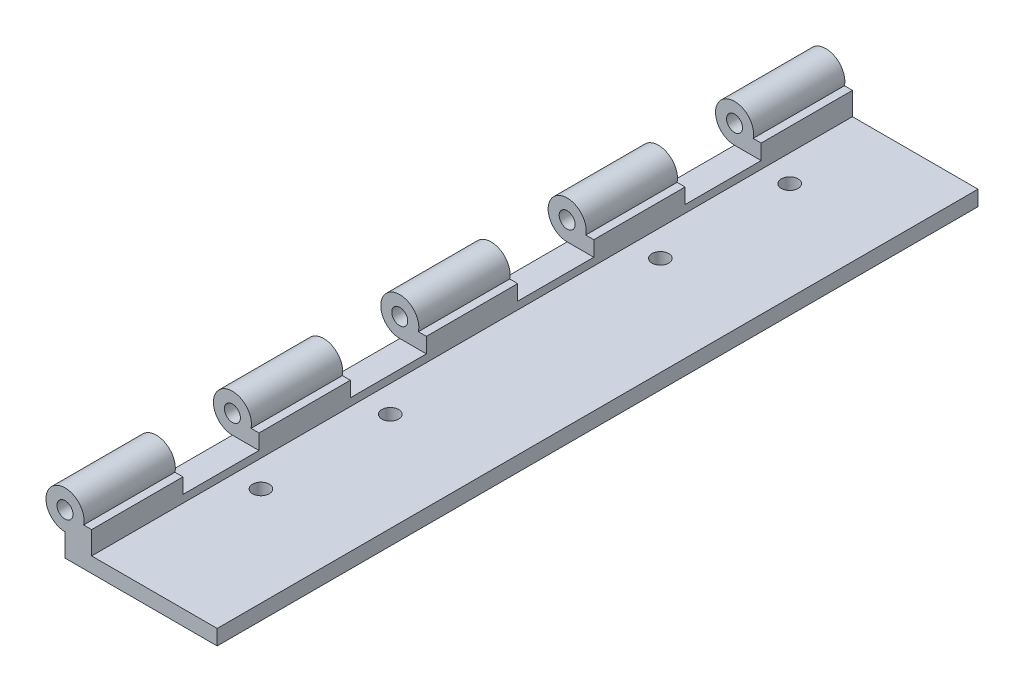
from build123d import *

# Parameters (mm, degrees)
SKETCH_1_W                     = 9.5
SKETCH_1_H                     = 13.25
EXTRUDE_1_DEPTH                = 2
EXTRUDE_2_DEPTH                = 12
PATTERN_LINEAR_1_COUNT         = 5
PATTERN_LINEAR_1_PITCH         = 22
HOLE_WIZARD_2_2_2_2_1_D        = 2.1
EXTRUDE_3_DEPTH                = 12
SKETCH_7_W                     = 1.05
SKETCH_7_H                     = 15
EXTRUDE_4_DEPTH                = 110
SKETCH_13_W                    = 1
SKETCH_13_H                    = 38.681287062
HOLE_WIZARD_2_0_2_2_AT_2_COUNT = 2
HOLE_WIZARD_2_0_2_2_AT_2_PITCH = 47
CUT_EXTRUDE_1_DEPTH            = 140.431241936
CUT_EXTRUDE_1_DEPTH_BACK       = 140.431241936
SKETCH_14_W                    = 52.846717088
SKETCH_14_H                    = 8
EXTRUDE23_DEPTH                = 109
EXTRUDE23_DEPTH_BACK           = 77
SKETCH18_W                     = 126.116691802
SKETCH18_H                     = 130.968537131
SKETCH20_W                     = 20
SKETCH20_H                     = 100
EXTRUDE24_DEPTH                = 2
SKETCH21_R                     = 1.1
EXTRUDE25_DEPTH                = 2
EXTRUDE26_DEPTH                = 136
EXTRUDE26_DEPTH_BACK           = 62
SKETCH22_W                     = 135.680863596
SKETCH22_H                     = 114.529775135
SKETCH_15_W                    = 16.5
SKETCH_15_H                    = 100
CUT_EXTRUDE_2_DEPTH            = 1
SKETCH_16_W                    = 20
SKETCH_16_H                    = 100
SKETCH_16_R                    = 1.1
EXTRUDE_5_DEPTH                = 1


with BuildPart() as part:
    # 草图1 → 凸台-拉伸1 (new body)
    with BuildSketch(Plane(origin=(0, 0, 0), x_dir=(1, 0, 0), z_dir=(0, 1, 0))):
        Polygon((21.5, 0), (21.5, 110), (9, 110), (0, 101), (0, 0), align=None)
        Polygon((19.121320344, 101), (4.242640687, 101), (8.121320344, 104.878679656), (19.121320344, 104.878679656), align=None, mode=Mode.SUBTRACT)
        with Locations((10.75, 12.625)):
            Rectangle(SKETCH_1_W, SKETCH_1_H, mode=Mode.SUBTRACT)
        with Locations((10.75, 37.875)):
            Rectangle(SKETCH_1_W, SKETCH_1_H, mode=Mode.SUBTRACT)
        with Locations((10.75, 63.125)):
            Rectangle(SKETCH_1_W, SKETCH_1_H, mode=Mode.SUBTRACT)
        with Locations((10.75, 88.375)):
            Rectangle(SKETCH_1_W, SKETCH_1_H, mode=Mode.SUBTRACT)
    extrude(amount=EXTRUDE_1_DEPTH)

    # 草图2 → 凸台-拉伸2 (add)
    with BuildSketch(Plane(origin=(0, 0, -101), x_dir=(-1, 0, 0), z_dir=(0, 0, -1))):
        with BuildLine():
            Line((0, 2), (0, 0))
            Line((0, 0), (3.5, 0))
            ThreePointArc((3.5, 0), (5.08113883, 4.436491673), (1.050510257, 2))
            Line((1.050510257, 2), (0, 2))
        make_face()
    extrude_2 = extrude(amount=-EXTRUDE_2_DEPTH)

    # 阵列(线性)1: 凸台-拉伸2 ×5
    with Locations(*[(0, 0, i * PATTERN_LINEAR_1_PITCH) for i in range(1, PATTERN_LINEAR_1_COUNT)]):
        add(extrude_2)

    # Ø2.2 (2.2) 直径孔1 (through all)
    with Locations(Plane(origin=(0, 0, -101), x_dir=(-1, 0, 0), z_dir=(0, 0, -1))):
        with Locations((3.5, 2.5)):
            Hole(HOLE_WIZARD_2_2_2_2_1_D / 2)

    # 草图8 → 凸台-拉伸4 (add)
    with BuildSketch(Plane.XY):
        with BuildLine():
            ThreePointArc((31.5, 0), (34.178784027, 0.532843272), (36.449747468, 2.050252532))
            Line((36.449747468, 2.050252532), (39.577164466, 5.17766953))
            ThreePointArc((39.577164466, 5.17766953), (57.254833996, 12.5), (74.932503526, 5.17766953))
            Line((74.932503526, 5.17766953), (76.346717088, 6.591883092))
            ThreePointArc((76.346717088, 6.591883092), (57.254833996, 14.5), (38.162950904, 6.591883092))
            Line((38.162950904, 6.591883092), (35.035533906, 3.464466094))
            ThreePointArc((35.035533906, 3.464466094), (33.413417162, 2.380602337), (31.5, 2))
            Line((31.5, 2), (21.5, 2))
            Line((21.5, 2), (21.5, 0))
            Line((21.5, 0), (31.5, 0))
        make_face()
    extrude(amount=-EXTRUDE_4_DEPTH)

    # 草图13 → Ø2.0 (2) 直径孔2 (revolve, cut)
    with BuildSketch(Plane(origin=(66.489377866, 12.871700761, -5), x_dir=(-0.9396926207859126, 0.34202014332565694, 0), z_dir=(0, 0, 1))):
        with Locations((0.5, 19.340643531)):
            Rectangle(SKETCH_13_W, SKETCH_13_H)
    hole_wizard_2_0_2_2 = revolve(axis=Axis((68.661205776, 18.838748903, -5), (-0.3420201433256569, -0.9396926207859128, 0)), mode=Mode.SUBTRACT)

    # Ø2.0 (2) 直径孔2 at 2: Ø2.0 (2) 直径孔2 ×2
    with Locations(*[(0, 0, -i * HOLE_WIZARD_2_0_2_2_AT_2_PITCH) for i in range(1, HOLE_WIZARD_2_0_2_2_AT_2_COUNT)]):
        add(hole_wizard_2_0_2_2, mode=Mode.SUBTRACT)

    # 草图14 → 切除-拉伸1 (cut, two sides: drawn at the far end of the back side and taken through both)
    with BuildSketch(Plane(origin=(0, 2, 0), x_dir=(1, 0, 0), z_dir=(0, 1, 0)).offset(-CUT_EXTRUDE_1_DEPTH_BACK)):
        with BuildLine():
            add(Edge.make_bspline(
                [(65.543349365, 52), (65.543349365, 51.867858182), (65.568139282, 51.738193315), (65.663651177, 51.49599396), (65.734288369, 51.385069362), (65.909329104, 51.20058787), (66.014984918, 51.126085586), (66.242291721, 51.026337096), (66.366299142, 51.000069682), (66.611454679, 50.999930602), (66.734292904, 51.025809235), (66.960669981, 51.125923854), (67.063423157, 51.199243917), (67.237262204, 51.385832013), (67.305425299, 51.495895945), (67.398649167, 51.738239585), (67.422691544, 51.869119898), (67.422777552, 52.130169285), (67.398544475, 52.261724961), (67.306168595, 52.502477284), (67.237041074, 52.614131138), (67.065581718, 52.798710334), (66.962099904, 52.873181003), (66.736029766, 52.973681753), (66.61428089, 52.999865952), (66.366377399, 53.000133023), (66.24402893, 52.974291959), (66.014886358, 52.874003493), (65.90992169, 52.799906628), (65.647004042, 52.52319771), (65.543349365, 52.264283637), (65.543349365, 52)],
                knots=[0, 0, 0, 0, 0.0625, 0.0625, 0.125, 0.125, 0.1875, 0.1875, 0.25, 0.25, 0.3125, 0.3125, 0.375, 0.375, 0.4375, 0.4375, 0.5, 0.5, 0.5625, 0.5625, 0.625, 0.625, 0.6875, 0.6875, 0.75, 0.75, 0.8125, 0.8125, 0.875, 0.875, 1, 1, 1, 1], degree=3))
        make_face()
        with BuildLine():
            add(Edge.make_bspline(
                [(65.543349365, 5), (65.543349365, 4.867858182), (65.568139282, 4.738193315), (65.663651177, 4.49599396), (65.734288369, 4.385069362), (65.909329104, 4.20058787), (66.014984918, 4.126085586), (66.242291721, 4.026337096), (66.366299142, 4.000069682), (66.611454679, 3.999930602), (66.734292904, 4.025809235), (66.960669981, 4.125923854), (67.063423157, 4.199243917), (67.237262204, 4.385832013), (67.305425299, 4.495895945), (67.398649167, 4.738239585), (67.422691544, 4.869119898), (67.422777552, 5.130169285), (67.398544475, 5.261724961), (67.306168595, 5.502477284), (67.237041074, 5.614131138), (67.065581718, 5.798710334), (66.962099904, 5.873181003), (66.736029766, 5.973681753), (66.61428089, 5.999865952), (66.366377399, 6.000133023), (66.24402893, 5.974291959), (66.014886358, 5.874003493), (65.90992169, 5.799906628), (65.647004042, 5.52319771), (65.543349365, 5.264283637), (65.543349365, 5)],
                knots=[0, 0, 0, 0, 0.0625, 0.0625, 0.125, 0.125, 0.1875, 0.1875, 0.25, 0.25, 0.3125, 0.3125, 0.375, 0.375, 0.4375, 0.4375, 0.5, 0.5, 0.5625, 0.5625, 0.625, 0.625, 0.6875, 0.6875, 0.75, 0.75, 0.8125, 0.8125, 0.875, 0.875, 1, 1, 1, 1], degree=3))
        make_face()
        with Locations((46.923358544, 14)):
            Rectangle(SKETCH_14_W, SKETCH_14_H)
        with Locations((46.923358544, 61)):
            Rectangle(SKETCH_14_W, SKETCH_14_H)
    extrude(amount=CUT_EXTRUDE_1_DEPTH + CUT_EXTRUDE_1_DEPTH_BACK, mode=Mode.SUBTRACT)

    # Sketch18 → Extrude23 (cut, two sides: drawn at the far end of the back side and taken through both)
    with BuildSketch(Plane(origin=(0, 2, 0), x_dir=(1, 0, 0), z_dir=(0, 1, 0)).offset(-EXTRUDE23_DEPTH_BACK)):
        with Locations((63.058345901, 59.008314148)):
            Rectangle(SKETCH18_W, SKETCH18_H)
    extrude(amount=EXTRUDE23_DEPTH + EXTRUDE23_DEPTH_BACK, mode=Mode.SUBTRACT)


with BuildPart() as body_2:
    # 草图5 → 凸台-拉伸3 (new body)
    with BuildSketch(Plane(origin=(9, 0, 0), x_dir=(0, 0, -1), z_dir=(1, 0, 0))):
        with BuildLine():
            Line((-111.050510257, 0), (-109.949581771, 0))
            Line((-109.949581771, 0), (-109.949581771, 2))
            Line((-109.949581771, 2), (-113.5, 2))
            ThreePointArc((-113.5, 2), (-115.08113883, -2.436491673), (-111.050510257, 0))
        make_face()
    extrude(amount=-EXTRUDE_3_DEPTH)

    # 草图7 → Ø2.2 (2.2) 直径孔2 (revolve, cut)
    with BuildSketch(Plane(origin=(9, -0.5, 113.5), x_dir=(0, 0, -1), z_dir=(0, 1, 0))):
        with Locations((0.525, 7.5)):
            Rectangle(SKETCH_7_W, SKETCH_7_H)
    revolve(axis=Axis((15.35, -0.5, 113.5), (-1, 0, 0)), mode=Mode.SUBTRACT)

    # Sketch22 → Extrude26 (cut, two sides: drawn at the far end of the back side and taken through both)
    with BuildSketch(Plane(origin=(0, 0, 0), x_dir=(1, 0, 0), z_dir=(0, 1, 0)).offset(-EXTRUDE26_DEPTH_BACK)):
        with Locations((8.341327017, -106.523866824)):
            Rectangle(SKETCH22_W, SKETCH22_H)
    extrude(amount=EXTRUDE26_DEPTH + EXTRUDE26_DEPTH_BACK, mode=Mode.SUBTRACT)


with BuildPart() as extrude23_piece_1:
    # of the separate pieces the step leaves, piece 1, a body of its own (extrude23_pieces)
    add(part.part.solids().sort_by_distance((0, 2, -101))[0])



with BuildPart() as extrude23_piece_2:
    # of the separate pieces the step leaves, piece 2, a body of its own (extrude23_pieces)
    add(part.part.solids().sort_by_distance((0, 2, -79))[0])


with BuildPart() as extrude23_piece_3:
    # of the separate pieces the step leaves, piece 3, a body of its own (extrude23_pieces)
    add(part.part.solids().sort_by_distance((0, 2, -57))[0])


with BuildPart() as extrude23_piece_4:
    # of the separate pieces the step leaves, piece 4, a body of its own (extrude23_pieces)
    add(part.part.solids().sort_by_distance((0, 2, -35))[0])


with BuildPart() as extrude23_piece_5:
    # of the separate pieces the step leaves, piece 5, a body of its own (extrude23_pieces)
    add(part.part.solids().sort_by_distance((-1.050510257, 2, -1))[0])


with BuildPart() as extrude23_piece_1_1:
    add(extrude23_piece_1.part)

    add(extrude23_piece_2.part)  # Extrude24 merges Extrude23 piece 2

    add(extrude23_piece_3.part)  # Extrude24 merges Extrude23 piece 3

    add(extrude23_piece_4.part)  # Extrude24 merges Extrude23 piece 4

    add(extrude23_piece_5.part)  # Extrude24 merges Extrude23 piece 5
    # Sketch20 → Extrude24 (add)
    with BuildSketch(Plane(origin=(0, 0, 0), x_dir=(-1, 0, 0), z_dir=(0, -1, 0))):
        with Locations((-6.5, 51)):
            Rectangle(SKETCH20_W, SKETCH20_H)
    extrude(amount=EXTRUDE24_DEPTH)

    # Sketch21 → Extrude25 (cut)
    with BuildSketch(Plane(origin=(0, 0, 0), x_dir=(1, 0, 0), z_dir=(0, 1, 0))):
        with Locations(Location((3.5, 89.25, 0), (0, 0, 270))):
            Circle(SKETCH21_R)
        with Locations(Location((3.5, 72.25, 0), (0, 0, 270))):
            Circle(SKETCH21_R)
        with Locations(Location((3.5, 36.75, 0), (0, 0, 270))):
            Circle(SKETCH21_R)
        with Locations(Location((3.5, 19.75, 0), (0, 0, 270))):
            Circle(SKETCH21_R)
    extrude(amount=-EXTRUDE25_DEPTH, mode=Mode.SUBTRACT)

    # 草图15 → 切除-拉伸2 (cut)
    with BuildSketch(Plane(origin=(0, 0, 0), x_dir=(1, 0, 0), z_dir=(0, 1, 0))):
        with Locations((8.25, 51)):
            Rectangle(SKETCH_15_W, SKETCH_15_H)
    extrude(amount=-CUT_EXTRUDE_2_DEPTH, mode=Mode.SUBTRACT)

    # 草图16 → 凸台-拉伸5 (add)
    with BuildSketch(Plane(origin=(0, -2, 0), x_dir=(-1, 0, 0), z_dir=(0, -1, 0))):
        with Locations((-6.5, 51)):
            Rectangle(SKETCH_16_W, SKETCH_16_H)
        with Locations(Location((-3.5, 89.25, 0), (0, 0, 270))):
            Circle(SKETCH_16_R, mode=Mode.SUBTRACT)
        with Locations(Location((-3.5, 72.25, 0), (0, 0, 270))):
            Circle(SKETCH_16_R, mode=Mode.SUBTRACT)
        with Locations(Location((-3.5, 36.75, 0), (0, 0, 270))):
            Circle(SKETCH_16_R, mode=Mode.SUBTRACT)
        with Locations(Location((-3.5, 19.75, 0), (0, 0, 270))):
            Circle(SKETCH_16_R, mode=Mode.SUBTRACT)
    extrude(amount=EXTRUDE_5_DEPTH)


solid = extrude23_piece_1_1.part
